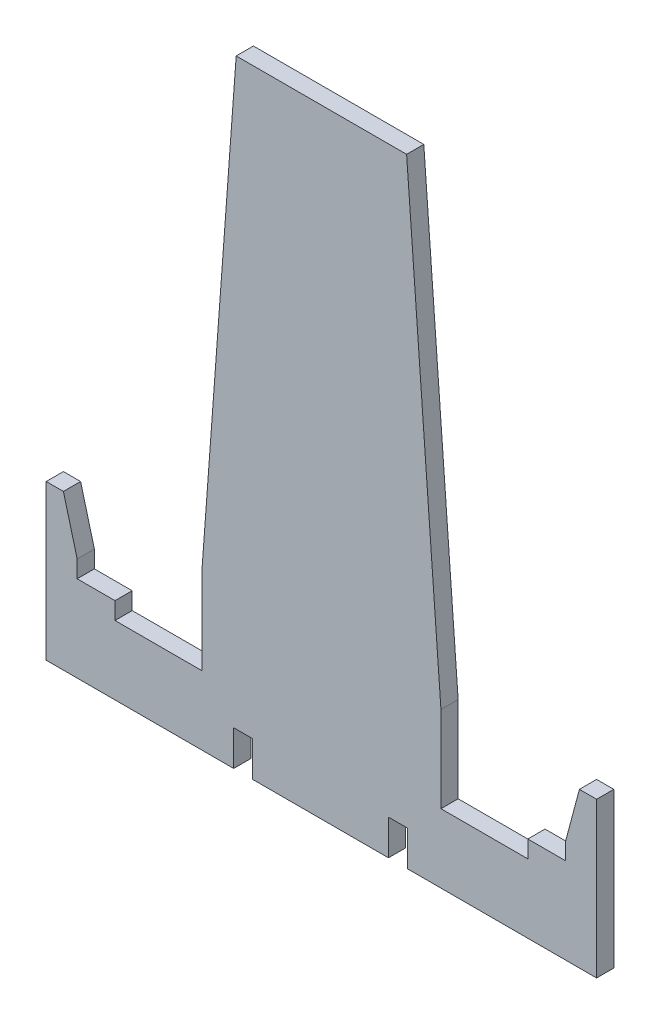
from build123d import *

# Parameters (mm, degrees)
BOSS_EXTRUDE1_DEPTH = 2.5


with BuildPart() as part:
    # Sketch2 → Boss-Extrude1 (new, symmetric)
    with BuildSketch(Plane.XY):
        Polygon((-641.002975542, -108.738333192), (-631.020809128, 26.020913401), (-581.485141956, 26.020913401), (-571.502975542, -108.738333192), (-571.502975542, -133.729086599), (-546.252975542, -133.729086599), (-546.252975542, -128.729086599), (-535.252975542, -128.729086599), (-535.252975542, -123.729086599), (-531.252975542, -108.729086599), (-526.252975542, -108.729086599), (-526.252975542, -153.729086599), (-581.252975542, -153.729086599), (-581.252975542, -143.479086599), (-586.752975542, -143.479086599), (-586.752975542, -153.729086599), (-626.252975542, -153.729086599), (-626.252975542, -143.479086599), (-631.752975542, -143.479086599), (-631.752975542, -153.729086599), (-686.252975542, -153.729086599), (-686.252975542, -108.729086599), (-681.252975542, -108.729086599), (-677.252975542, -123.729086599), (-677.252975542, -128.729086599), (-666.252975542, -128.729086599), (-666.252975542, -133.729086599), (-641.002975542, -133.729086599), align=None)
    extrude(amount=BOSS_EXTRUDE1_DEPTH, both=True)


solid = part.part
